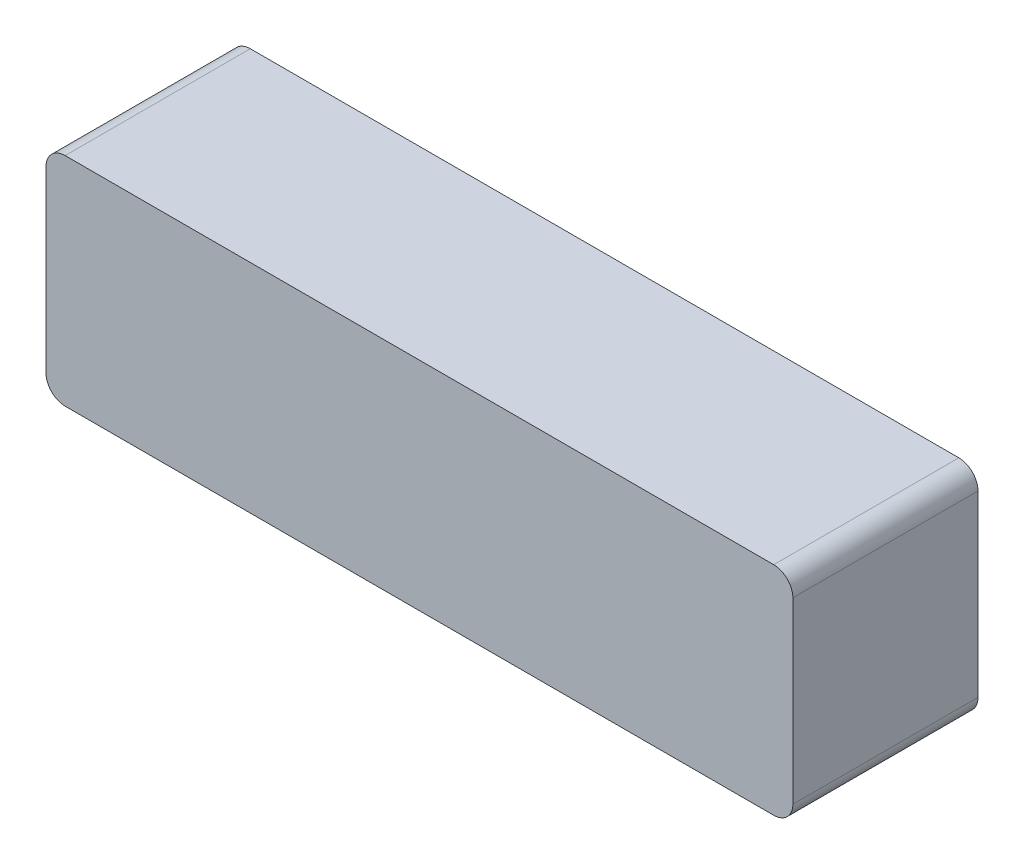
from build123d import *

# Parameters (mm, degrees)
EXTRUDE_1_DEPTH = 29


with BuildPart() as part:
    # 草图1 → 凸台-拉伸1 (new body)
    with BuildSketch(Plane.XY):
        with BuildLine():
            Line((-55.5, -17), (55.5, -17))
            ThreePointArc((55.5, -17), (57.621320344, -16.121320344), (58.5, -14))
            Line((58.5, -14), (58.5, 14))
            ThreePointArc((58.5, 14), (57.621320344, 16.121320344), (55.5, 17))
            Line((55.5, 17), (-55.5, 17))
            ThreePointArc((-55.5, 17), (-57.621320344, 16.121320344), (-58.5, 14))
            Line((-58.5, 14), (-58.5, -14))
            ThreePointArc((-58.5, -14), (-57.621320344, -16.121320344), (-55.5, -17))
        make_face()
    extrude(amount=EXTRUDE_1_DEPTH)


solid = part.part
